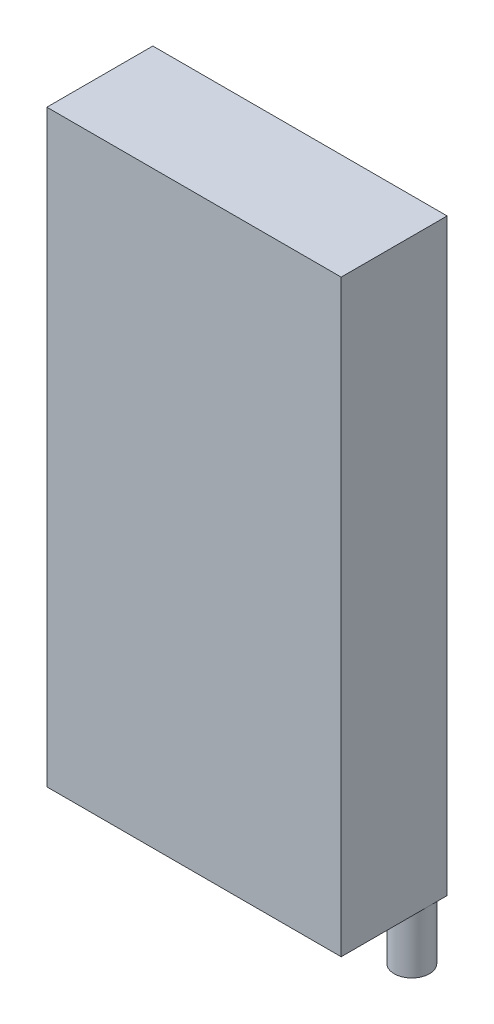
from build123d import *

# Parameters (mm, degrees)
SKETCH_1_W      = 25
SKETCH_1_H      = 50
EXTRUDE_1_DEPTH = 9
SKETCH_2_R      = 1.5
EXTRUDE_3_DEPTH = 5


with BuildPart() as part:
    # 草图1 → 凸台-拉伸1 (new body)
    with BuildSketch(Plane.XY):
        Rectangle(SKETCH_1_W, SKETCH_1_H)
    extrude(amount=EXTRUDE_1_DEPTH)

    # 草图2 → 凸台-拉伸3 (add)
    with BuildSketch(Plane.XZ.offset(25)):
        with Locations(Location((-11, 1.5, 0), (0, 0, 270))):
            Circle(SKETCH_2_R)
        with Locations(Location((11, 1.5, 0), (0, 0, 90))):
            Circle(SKETCH_2_R)
    extrude(amount=EXTRUDE_3_DEPTH)


solid = part.part
